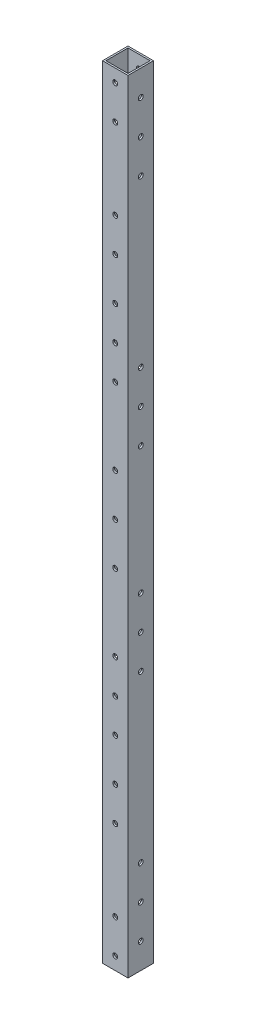
from build123d import *

# Parameters (mm, degrees)
SKETCH_1_W          = 15
SKETCH_1_H          = 15
SKETCH_1_W_2        = 13
SKETCH_1_H_2        = 13
EXTRUDE_1_DEPTH     = 460
SKETCH_2_R          = 1.45
CUT_EXTRUDE_1_DEPTH = 461.305605006
SKETCH_3_R          = 1.45
CUT_EXTRUDE_2_DEPTH = 461.305605006


with BuildPart() as part:
    # 草图1 → 拉伸-薄壁1 (new body)
    with BuildSketch(Plane(origin=(0, 0, 0), x_dir=(1, 0, 0), z_dir=(0, 1, 0))):
        Rectangle(SKETCH_1_W, SKETCH_1_H)
        Rectangle(SKETCH_1_W_2, SKETCH_1_H_2, mode=Mode.SUBTRACT)
    extrude(amount=EXTRUDE_1_DEPTH)

    # 草图2 → 切除-拉伸1 (cut, through all)
    with BuildSketch(Plane.XY.offset(7.5)):
        with Locations((0, 7.5)):
            Circle(SKETCH_2_R)
        with Locations((0, 27.5)):
            Circle(SKETCH_2_R)
        with Locations(Location((0, 432.5, 0), (0, 0, 180))):
            Circle(SKETCH_2_R)
        with Locations(Location((0, 452.5, 0), (0, 0, 180))):
            Circle(SKETCH_2_R)
        with Locations((0, 140)):
            Circle(SKETCH_2_R)
        with Locations((0, 160)):
            Circle(SKETCH_2_R)
        with Locations((0, 120)):
            Circle(SKETCH_2_R)
        with Locations(Location((0, 340, 0), (0, 0, 180))):
            Circle(SKETCH_2_R)
        with Locations(Location((0, 300, 0), (0, 0, 180))):
            Circle(SKETCH_2_R)
        with Locations(Location((0, 320, 0), (0, 0, 180))):
            Circle(SKETCH_2_R)
        with Locations((0, 230)):
            Circle(SKETCH_2_R)
        with Locations((0, 255)):
            Circle(SKETCH_2_R)
        with Locations((0, 205)):
            Circle(SKETCH_2_R)
        with Locations((0, 95)):
            Circle(SKETCH_2_R)
        with Locations(Location((0, 365, 0), (0, 0, 180))):
            Circle(SKETCH_2_R)
        with Locations((0, 75)):
            Circle(SKETCH_2_R)
        with Locations(Location((0, 385, 0), (0, 0, 180))):
            Circle(SKETCH_2_R)
    extrude(amount=-CUT_EXTRUDE_1_DEPTH, mode=Mode.SUBTRACT)

    # 草图3 → 切除-拉伸2 (cut, through all)
    with BuildSketch(Plane(origin=(7.5, 0, 0), x_dir=(0, 0, -1), z_dir=(1, 0, 0))):
        with Locations((0, 15)):
            Circle(SKETCH_3_R)
        with Locations((0, 35)):
            Circle(SKETCH_3_R)
        with Locations((0, 425)):
            Circle(SKETCH_3_R)
        with Locations((0, 445)):
            Circle(SKETCH_3_R)
        with Locations((0, 172.5)):
            Circle(SKETCH_3_R)
        with Locations((0, 192.5)):
            Circle(SKETCH_3_R)
        with Locations((0, 152.5)):
            Circle(SKETCH_3_R)
        with Locations((0, 307.5)):
            Circle(SKETCH_3_R)
        with Locations((0, 267.5)):
            Circle(SKETCH_3_R)
        with Locations((0, 287.5)):
            Circle(SKETCH_3_R)
        with Locations((0, 55)):
            Circle(SKETCH_3_R)
        with Locations((0, 405)):
            Circle(SKETCH_3_R)
    extrude(amount=-CUT_EXTRUDE_2_DEPTH, mode=Mode.SUBTRACT)


solid = part.part
